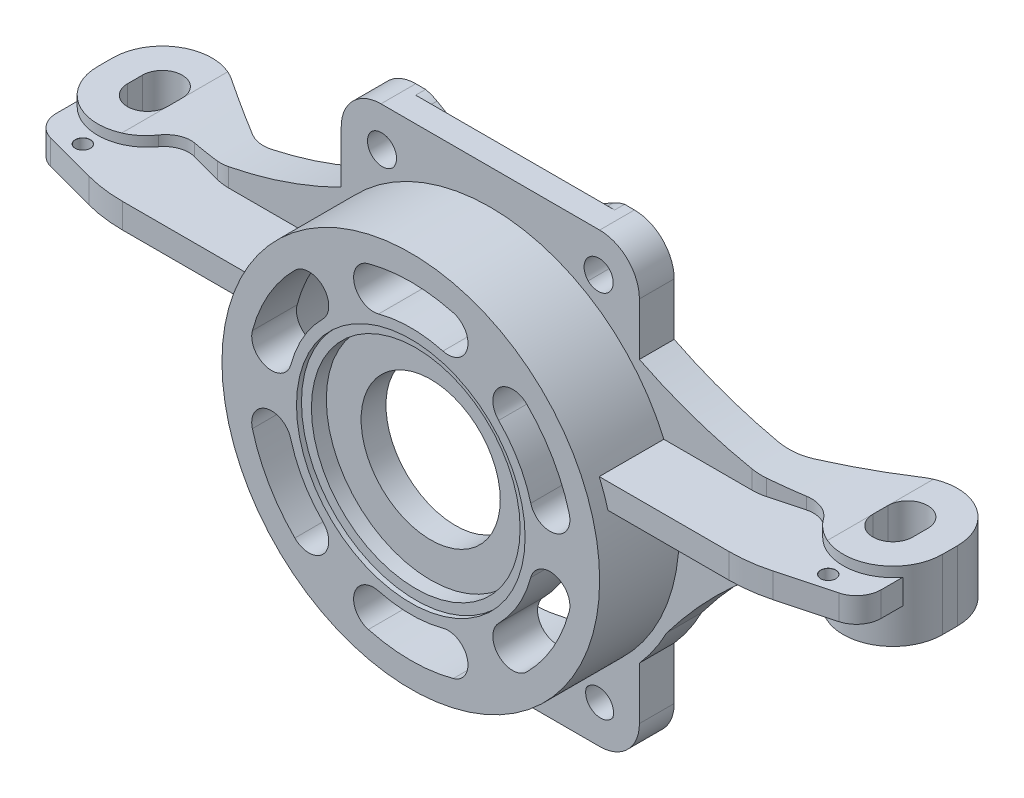
from build123d import *
from OCP.BRepFilletAPI import BRepFilletAPI_MakeFillet
from build123d.topology import SkipClean

# Parameters (mm, degrees)
BOSS_EXTRUDE2_DEPTH                = 7
FILLET1_R                          = 8
F_6_0_6_DIAMETER_HOLE1_AT_2_COUNT  = 2
F_6_0_6_DIAMETER_HOLE1_AT_2_PITCH  = 43.98121468
F_6_0_6_DIAMETER_HOLE1_AT_3_COUNT  = 2
F_6_0_6_DIAMETER_HOLE1_AT_3_PITCH  = 86.569441392
F_6_0_6_DIAMETER_HOLE1_AT_4_COUNT  = 2
F_6_0_6_DIAMETER_HOLE1_AT_4_PITCH  = 74.902535006
CUT_EXTRUDE2_DEPTH                 = 9
CUT_EXTRUDE4_START                 = -2
CUT_EXTRUDE4_DEPTH                 = 2
CIRPATTERN1_COUNT                  = 6
BOSS_EXTRUDE3_DEPTH                = 26.457513
BOSS_EXTRUDE3_DEPTH_BACK           = 26.457513
BOSS_EXTRUDE4_REACH                = 96.626
SKETCH14_W                         = 52.915026222
SKETCH14_H                         = 7
FILLET3_R1                         = 5
FILLET3_R2                         = 10
BOSS_EXTRUDE5_DEPTH                = 5
SKETCH24_W                         = 5
SKETCH24_H                         = 13
BOSS_EXTRUDE6_DEPTH                = 3.0858195
FILLET4_R1                         = 5
FILLET4_R2                         = 30
F_3_0_3_DIAMETER_HOLE1_D           = 3
F_3_0_3_DIAMETER_HOLE1_CSINK_D     = 3.05
F_3_0_3_DIAMETER_HOLE1_CSINK_ANGLE = 100
CUT_EXTRUDE5_DEPTH                 = 99.03570778
CUT_EXTRUDE5_DEPTH_BACK            = 99.03570778


with BuildPart() as part:
    # Sketch2 → Revolve1 (revolve)
    with BuildSketch(Plane.YZ, mode=Mode.PRIVATE) as revolve1_sk:
        Polygon((14, 19), (14, 14), (34, 14), (34, 0), (38, 0), (38, 23), (23, 23), (23, 22), (21, 22), (21, 19), align=None)
    revolve(revolve1_sk.sketch.rotate(Axis((0, 0, 35.592631609), (0, 0, -1)), 90), axis=Axis((0, 0, 35.592631609), (0, 0, -1)))

    # Sketch10 → Cut-Extrude2 (cut)
    with BuildSketch(Plane.XY.offset(23)):
        with BuildLine():
            ThreePointArc((8.541028488, 31.875552268), (0, 33), (-8.541028488, 31.875552268))
            ThreePointArc((-8.541028488, 31.875552268), (-11.369455613, 26.976572782), (-6.470476128, 24.148145657))
            ThreePointArc((-6.470476128, 24.148145657), (0, 25), (6.470476128, 24.148145657))
            ThreePointArc((6.470476128, 24.148145657), (11.369455613, 26.976572782), (8.541028488, 31.875552268))
        make_face()
    cut_extrude2 = extrude(amount=-CUT_EXTRUDE2_DEPTH, mode=Mode.SUBTRACT)

    # CirPattern1: Cut-Extrude2 ×6 about axis
    cirpattern1_axis = Axis((0, 0, 0), (0, 0, 1))
    for i in range(1, CIRPATTERN1_COUNT):
        add(cut_extrude2.rotate(cirpattern1_axis, i * 360 / CIRPATTERN1_COUNT), mode=Mode.SUBTRACT)

    # Sketch14 → Boss-Extrude4 (add, up to next)
    with BuildSketch(Plane.YZ.offset(-40), mode=Mode.PRIVATE) as boss_extrude4_sk1:
        with Locations((0, 3.5)):
            Rectangle(SKETCH14_W, SKETCH14_H)
    boss_extrude4_tool1 = extrude(boss_extrude4_sk1.sketch, amount=BOSS_EXTRUDE4_REACH, mode=Mode.PRIVATE) - part.part


with BuildPart() as body_2:
    # Sketch3 → Boss-Extrude2 (new body)
    with BuildSketch(Plane(origin=(0, 0, 0), x_dir=(1, 0, 0), z_dir=(0, 0, -1))):
        with BuildLine():
            Line((30, 45), (-30, 45))
            Line((-30, 45), (-30, 26.457513111))
            ThreePointArc((-30, 26.457513111), (0, 40), (30, 26.457513111))
            Line((30, 26.457513111), (30, 45))
        make_face()
        with BuildLine():
            Line((-30, 23.323807579), (-30, 26.457513111))
            ThreePointArc((-30, 26.457513111), (-40, 0), (-30, -26.457513111))
            Line((-30, -26.457513111), (-30, -23.323807579))
            ThreePointArc((-30, -23.323807579), (-38, 0), (-30, 23.323807579))
        make_face()
        with BuildLine():
            ThreePointArc((40, 0), (37.416573868, 14.142135624), (30, 26.457513111))
            Line((30, 26.457513111), (30, 23.323807579))
            ThreePointArc((30, 23.323807579), (35.944401511, 12.328828006), (38, 0))
            ThreePointArc((38, 0), (35.944401511, -12.328828006), (30, -23.323807579))
            Line((30, -23.323807579), (30, -26.457513111))
            ThreePointArc((30, -26.457513111), (37.416573868, -14.142135624), (40, 0))
        make_face()
        with BuildLine():
            ThreePointArc((30, -26.457513111), (0, -40), (-30, -26.457513111))
            Line((-30, -26.457513111), (-30, -45))
            Line((-30, -45), (30, -45))
            Line((30, -45), (30, -26.457513111))
        make_face()
        with BuildLine():
            ThreePointArc((30, 26.457513111), (0, 40), (-30, 26.457513111))
            Line((-30, 26.457513111), (-30, 23.323807579))
            ThreePointArc((-30, 23.323807579), (0, 38), (30, 23.323807579))
            Line((30, 23.323807579), (30, 26.457513111))
        make_face()
        with BuildLine():
            Line((-30, -23.323807579), (-30, -26.457513111))
            ThreePointArc((-30, -26.457513111), (0, -40), (30, -26.457513111))
            Line((30, -26.457513111), (30, -23.323807579))
            ThreePointArc((30, -23.323807579), (0, -38), (-30, -23.323807579))
        make_face()
        with BuildLine():
            ThreePointArc((30, 26.457513111), (0, 40), (-30, 26.457513111))
            Line((-30, 26.457513111), (-30, 23.323807579))
            ThreePointArc((-30, 23.323807579), (0, 38), (30, 23.323807579))
            Line((30, 23.323807579), (30, 26.457513111))
        make_face()
        with BuildLine():
            Line((-30, -23.323807579), (-30, -26.457513111))
            ThreePointArc((-30, -26.457513111), (0, -40), (30, -26.457513111))
            Line((30, -26.457513111), (30, -23.323807579))
            ThreePointArc((30, -23.323807579), (0, -38), (-30, -23.323807579))
        make_face()
        with BuildLine():
            Line((-30, 16), (-30, 23.323807579))
            ThreePointArc((-30, 23.323807579), (-38, 0), (-30, -23.323807579))
            Line((-30, -23.323807579), (-30, -16))
            ThreePointArc((-30, -16), (-34, 0), (-30, 16))
        make_face()
        with BuildLine():
            ThreePointArc((30, 23.323807579), (0, 38), (-30, 23.323807579))
            Line((-30, 23.323807579), (-30, 16))
            ThreePointArc((-30, 16), (0, 34), (30, 16))
            Line((30, 16), (30, 23.323807579))
        make_face()
        with BuildLine():
            Line((-30, -16), (-30, -23.323807579))
            ThreePointArc((-30, -23.323807579), (0, -38), (30, -23.323807579))
            Line((30, -23.323807579), (30, -16))
            ThreePointArc((30, -16), (0, -34), (-30, -16))
        make_face()
        with BuildLine():
            ThreePointArc((38, 0), (35.944401511, 12.328828006), (30, 23.323807579))
            Line((30, 23.323807579), (30, 16))
            ThreePointArc((30, 16), (32.984845005, 8.246211251), (34, 0))
            ThreePointArc((34, 0), (32.984845005, -8.246211251), (30, -16))
            Line((30, -16), (30, -23.323807579))
            ThreePointArc((30, -23.323807579), (35.944401511, -12.328828006), (38, 0))
        make_face()
        with BuildLine():
            ThreePointArc((30, 23.323807579), (0, 38), (-30, 23.323807579))
            Line((-30, 23.323807579), (-30, 16))
            ThreePointArc((-30, 16), (0, 34), (30, 16))
            Line((30, 16), (30, 23.323807579))
        make_face()
        with BuildLine():
            Line((-30, -16), (-30, -23.323807579))
            ThreePointArc((-30, -23.323807579), (0, -38), (30, -23.323807579))
            Line((30, -23.323807579), (30, -16))
            ThreePointArc((30, -16), (0, -34), (-30, -16))
        make_face()
    extrude(amount=-BOSS_EXTRUDE2_DEPTH)

    # Fillet1
    fillet1_edges = [body_2.edges().sort_by_distance(p)[0] for p in [
        (-30, -45, 3.5),
        (30, -45, 3.5),
        (30, 45, 3.5),
        (-30, 45, 3.5),
    ]]
    fillet(fillet1_edges, radius=FILLET1_R)

    # Sketch7 → Ø6.0 (6) Diameter Hole1 (revolve, cut)
    with BuildSketch(Plane(origin=(21.795398336, -37.719853106, 0), x_dir=(0, 1, 0), z_dir=(1, 0, 0))):
        Polygon((0, 0), (0, 23), (3, 23), (3, 0.020977491), (3.025, 0), align=None)
    f_6_0_6_diameter_hole1 = revolve(axis=Axis((21.795398336, -37.719853106, -6.35), (0, 0, 1)), mode=Mode.SUBTRACT)

    # Ø6.0 (6) Diameter Hole1 at 2: Ø6.0 (6) Diameter Hole1 ×2
    with Locations(*[Vector(-0.9998477485040079, 0.017449349886632153, 0) * (i * F_6_0_6_DIAMETER_HOLE1_AT_2_PITCH) for i in range(1, F_6_0_6_DIAMETER_HOLE1_AT_2_COUNT)]):
        add(f_6_0_6_diameter_hole1, mode=Mode.SUBTRACT)

    # Ø6.0 (6) Diameter Hole1 at 3: Ø6.0 (6) Diameter Hole1 ×2
    with Locations(*[Vector(-0.5044221186002447, 0.8634571942295929, 0) * (i * F_6_0_6_DIAMETER_HOLE1_AT_3_PITCH) for i in range(1, F_6_0_6_DIAMETER_HOLE1_AT_3_COUNT)]):
        add(f_6_0_6_diameter_hole1, mode=Mode.SUBTRACT)

    # Ø6.0 (6) Diameter Hole1 at 4: Ø6.0 (6) Diameter Hole1 ×2
    with Locations(*[Vector(-0.0010245896261351032, 0.9999994751079112, 0) * (i * F_6_0_6_DIAMETER_HOLE1_AT_4_PITCH) for i in range(1, F_6_0_6_DIAMETER_HOLE1_AT_4_COUNT)]):
        add(f_6_0_6_diameter_hole1, mode=Mode.SUBTRACT)

    # Sketch23 → Cut-Extrude4 (cut)
    with BuildSketch(Plane(origin=(0, 0, 0), x_dir=(-1, 0, 0), z_dir=(0, 0, -1)).offset(CUT_EXTRUDE4_START)):
        with BuildLine():
            Line((6.564247855, 37.428740963), (17.872142697, 43.957357094))
            ThreePointArc((17.872142697, 43.957357094), (19.473623532, 44.661133018), (21.189785116, 45))
            Line((21.189785116, 45), (-20.018970761, 45))
            ThreePointArc((-20.018970761, 45), (-18.834343663, 44.644596351), (-17.718653976, 44.110845814))
            Line((-17.718653976, 44.110845814), (-6.240699269, 37.484045575))
            ThreePointArc((-6.240699269, 37.484045575), (0.164120602, 37.999645583), (6.564247855, 37.428740963))
        make_face()
    cut_extrude4 = extrude(amount=CUT_EXTRUDE4_DEPTH, mode=Mode.SUBTRACT)

    # Mirror1: Cut-Extrude4 across plane
    add(cut_extrude4.mirror(Plane.ZX), mode=Mode.SUBTRACT)


with BuildPart() as body_3:
    # Sketch11 → Boss-Extrude3 (new, two sides: drawn at the far end of the back side and taken through both)
    # profile 1 of 2: a face of its own
    with BuildSketch(Plane(origin=(0, 0, 0), x_dir=(-1, 0, 0), z_dir=(0, 1, 0)).offset(-BOSS_EXTRUDE3_DEPTH_BACK)):
        Polygon((40, 7), (54, 7), (65.440282065, 3.93458566), (69.446104466, -10.315903102), (54, 0), (40, 0), align=None)
    # profile 2 of 2: a face of its own
    with BuildSketch(Plane(origin=(0, 0, 0), x_dir=(-1, 0, 0), z_dir=(0, 1, 0)).offset(-BOSS_EXTRUDE3_DEPTH_BACK)):
        with BuildLine():
            Line((85, 1), (85, -2))
            ThreePointArc((85, -2), (75, -12), (65, -2))
            Line((65, -2), (65, 1))
            ThreePointArc((65, 1), (75, 11), (85, 1))
        make_face()
        with BuildLine():
            Line((79, 1), (79, -2))
            ThreePointArc((79, -2), (75, -6), (71, -2))
            Line((71, -2), (71, 1))
            ThreePointArc((71, 1), (75, 5), (79, 1))
        make_face(mode=Mode.SUBTRACT)
    extrude(amount=BOSS_EXTRUDE3_DEPTH + BOSS_EXTRUDE3_DEPTH_BACK)


with BuildPart() as part_1:
    add(part.part)

    add(body_2.part)  # Boss-Extrude4 merges body 2

    add(body_3.part)  # Boss-Extrude4 merges body 3
    add(boss_extrude4_tool1.solids().sort_by_distance((-40, 0, 3.5))[0])

    # Fillet3: one fillet with a radius per group of edges: ONE call of the kernel's fillet builder (fillet() takes one radius for all edges)
    fillet3_edges_1 = [part_1.edges().sort_by_distance(p)[0] for p in [
        (-65.440282065, 0, 3.93458566),
    ]]
    fillet3_edges_2 = [part_1.edges().sort_by_distance(p)[0] for p in [
        (-54, 0, 7),
        (-54, 0, 0),
    ]]
    fillet3 = BRepFilletAPI_MakeFillet(part_1.part.solid().wrapped)
    for e in fillet3_edges_1:
        fillet3.Add(FILLET3_R1, e.wrapped)
    for e in fillet3_edges_2:
        fillet3.Add(FILLET3_R2, e.wrapped)
    add(Compound.cast(fillet3.Shape()), mode=Mode.REPLACE)

    # Sketch19 → Boss-Extrude5 (add)
    with SkipClean():  # the faces are left unmerged after this step: merging them gives an invalid solid
        with BuildSketch(Plane(origin=(0, 10, 0), x_dir=(-1, 0, 0), z_dir=(0, -1, 0))):
            Polygon((61.897701835, -3.999659944), (83, -7), (83, -15.176914536), (65, -20), (38, -20), (38, -7), align=None)
        extrude(amount=-BOSS_EXTRUDE5_DEPTH)

    # Sketch24 → Boss-Extrude6 (add)
    with SkipClean():  # the faces are left unmerged after this step: merging them gives an invalid solid
        with BuildSketch(Plane.YZ.offset(-38)):
            with Locations((12.5, 13.5)):
                Rectangle(SKETCH24_W, SKETCH24_H)
        extrude(amount=BOSS_EXTRUDE6_DEPTH)

    # Fillet4: one fillet with a radius per group of edges: ONE call of the kernel's fillet builder (fillet() takes one radius for all edges)
    fillet4_edges_1 = [part_1.edges().sort_by_distance(p)[0] for p in [
        (-83, 12.5, 15.176914536),
    ]]
    fillet4_edges_2 = [part_1.edges().sort_by_distance(p)[0] for p in [
        (-65, 12.5, 20),
    ]]
    fillet4 = BRepFilletAPI_MakeFillet(part_1.part.solid().wrapped)
    for e in fillet4_edges_1:
        fillet4.Add(FILLET4_R1, e.wrapped)
    for e in fillet4_edges_2:
        fillet4.Add(FILLET4_R2, e.wrapped)
    add(Compound.cast(fillet4.Shape()), mode=Mode.REPLACE)

    # Ø3.0 (3) Diameter Hole1 (through all)
    with Locations(Plane(origin=(0, 15, 0), x_dir=(1, 0, 0), z_dir=(0, 1, 0))):
        with Locations((-75, -14)):
            CounterSinkHole(F_3_0_3_DIAMETER_HOLE1_D / 2, F_3_0_3_DIAMETER_HOLE1_CSINK_D / 2, counter_sink_angle=F_3_0_3_DIAMETER_HOLE1_CSINK_ANGLE)

    # Sketch25 → Cut-Extrude5 (cut, two sides: drawn at the far end of the back side and taken through both)
    with SkipClean():  # the faces are left unmerged after this step: merging them gives an invalid solid
        with BuildSketch(Plane.XY.offset(7).offset(-CUT_EXTRUDE5_DEPTH_BACK)):
            with BuildLine():
                Line((-85, 26.457513111), (-85, 17))
                Line((-85, 17), (-71, 17))
                ThreePointArc((-71, 17), (-61.797905562, 17.386287363), (-52.683475024, 18.711019768))
                Line((-52.683475024, 18.711019768), (-52.683475024, 26.457513111))
                Line((-52.683475024, 26.457513111), (-56.52161506, 26.457513111))
                Line((-56.52161506, 26.457513111), (-69.446104466, 26.457513111))
                Line((-69.446104466, 26.457513111), (-85, 26.457513111))
            make_face()
            with BuildLine():
                Line((-52.683475024, 26.457513111), (-52.683475024, 18.711019768))
                ThreePointArc((-52.683475024, 18.711019768), (-41.082693145, 21.825726263), (-30, 26.457513111))
                Line((-30, 26.457513111), (-50.967719526, 26.457513111))
                Line((-50.967719526, 26.457513111), (-52.683475024, 26.457513111))
            make_face()
            with BuildLine():
                Line((-57, 3), (-85, 3))
                Line((-85, 3), (-85, -26.457513111))
                Line((-85, -26.457513111), (-69.446104466, -26.457513111))
                Line((-69.446104466, -26.457513111), (-56.52161506, -26.457513111))
                Line((-56.52161506, -26.457513111), (-52.683475024, -26.457513111))
                Line((-52.683475024, -26.457513111), (-52.683475024, -0.407819059))
                ThreePointArc((-52.683475024, -0.407819059), (-54.820042274, 1.323570814), (-57, 3))
            make_face()
            with BuildLine():
                ThreePointArc((-30, -26.457513111), (-40.293557929, -12.519935389), (-52.683475024, -0.407819059))
                Line((-52.683475024, -0.407819059), (-52.683475024, -26.457513111))
                Line((-52.683475024, -26.457513111), (-50.967719526, -26.457513111))
                Line((-50.967719526, -26.457513111), (-30, -26.457513111))
            make_face()
        extrude(amount=CUT_EXTRUDE5_DEPTH + CUT_EXTRUDE5_DEPTH_BACK, mode=Mode.SUBTRACT)

    # Mirror4: part across plane


with BuildPart() as part_2:
    with SkipClean():  # the faces are left unmerged after this step: merging them gives an invalid solid
        add(part_1.part)
        add(part_1.part.mirror(Plane(origin=(0, 0, 0), x_dir=(0, 0, 1), z_dir=(1, 0, 0))))


solid = part_2.part
